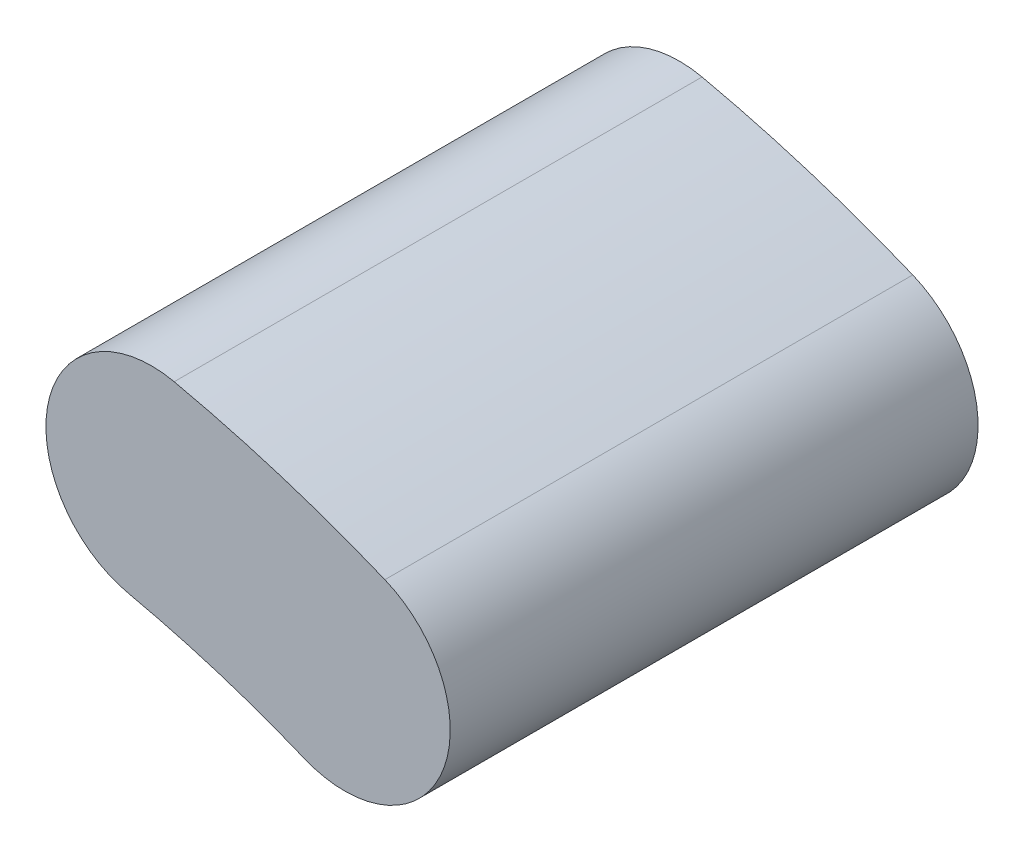
from build123d import *

# Parameters (mm, degrees)
BOSS_EXTRUDE1_DEPTH = 100


with BuildPart() as part:
    # Sketch1 → Boss-Extrude1 (new body)
    with BuildSketch(Plane.XY):
        with BuildLine():
            ThreePointArc((91.495588631, 221.875093828), (71.809731693, 229.005158095), (51.577359337, 234.392354832))
            ThreePointArc((51.577359337, 234.392354832), (27.746549823, 219.157771874), (42.981132781, 195.32696236))
            ThreePointArc((42.981132781, 195.32696236), (59.841443078, 190.837631746), (76.246323859, 184.895911523))
            ThreePointArc((76.246323859, 184.895911523), (102.360547397, 195.76087029), (91.495588631, 221.875093828))
        make_face()
    extrude(amount=BOSS_EXTRUDE1_DEPTH)


solid = part.part
